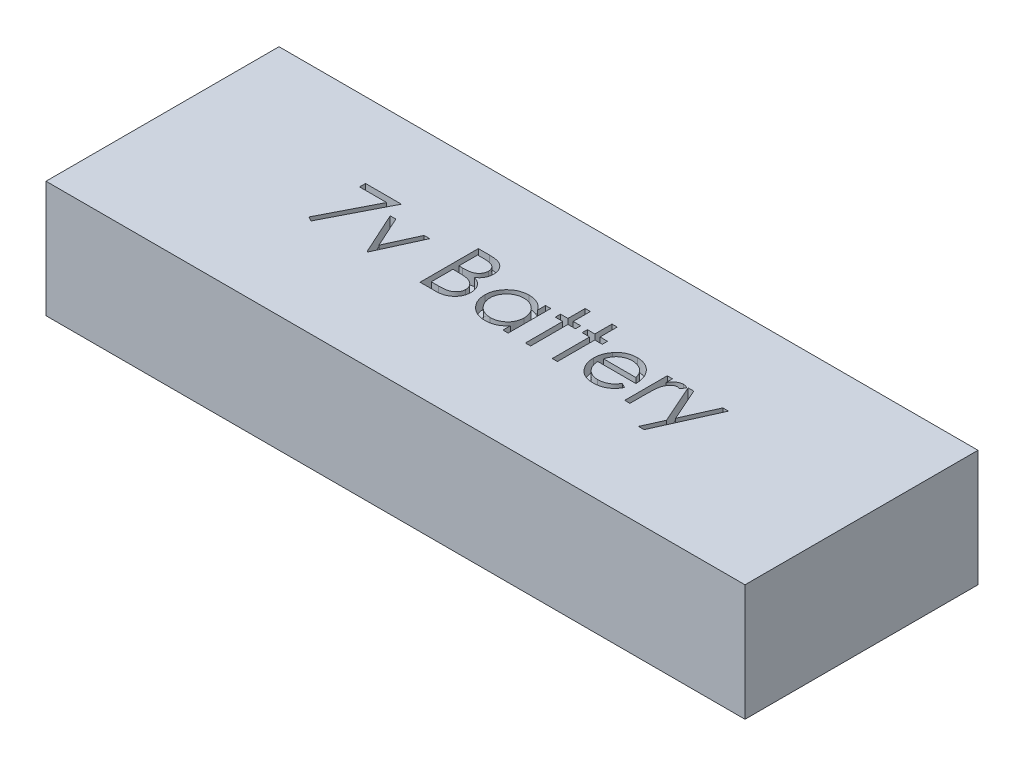
from build123d import *

# Parameters (mm, degrees)
SKETCH1_W           = 152.4
SKETCH1_H           = 50.8
BOSS_EXTRUDE1_DEPTH = 25.4
CUT_EXTRUDE1_DEPTH  = 2.54


with BuildPart() as part:
    # Sketch1 → Boss-Extrude1 (new body)
    with BuildSketch(Plane(origin=(0, 0, 0), x_dir=(1, 0, 0), z_dir=(0, 1, 0))):
        Rectangle(SKETCH1_W, SKETCH1_H)
    extrude(amount=BOSS_EXTRUDE1_DEPTH)

    # Sketch2 → Cut-Extrude1 (cut)
    # profile 1 of 9: a face of its own
    with BuildSketch(Plane(origin=(0, 25.4, 0), x_dir=(1, 0, 0), z_dir=(0, 1, 0))):
        Polygon((-40.938360226, 9.009477138), (-33.122975611, 9.009477138), (-39.798616636, -4.016163888), (-40.783171925, -3.474276869), (-35.051381059, 7.706913035), (-40.938360226, 7.706913035), align=None)
    # profile 2 of 9: a face of its own
    with BuildSketch(Plane(origin=(0, 25.4, 0), x_dir=(1, 0, 0), z_dir=(0, 1, 0))):
        Polygon((-32.146052534, 5.590246368), (-30.912178335, 5.590246368), (-27.831308944, -1.166804914), (-24.750439553, 5.590246368), (-23.516565354, 5.590246368), (-27.749898688, -3.690522862), (-27.9127192, -3.690522862), align=None)
    # profile 3 of 9: a face of its own
    with BuildSketch(Plane(origin=(0, 25.4, 0), x_dir=(1, 0, 0), z_dir=(0, 1, 0))):
        with BuildLine():
            Line((-16.35246279, 9.009477138), (-13.874538111, 9.009477138))
            add(Edge.make_bspline(
                [(-13.874538111, 9.009477138), (-13.75324049, 9.008839415), (-13.518135512, 9.007603349), (-13.176253538, 8.98843313), (-12.856036425, 8.9622941), (-12.557391308, 8.920819192), (-12.280456188, 8.870774744), (-12.024396476, 8.810171011), (-11.790026422, 8.737503013), (-11.51021735, 8.621946507), (-11.191190952, 8.45023101), (-10.845756784, 8.196490216), (-10.550375687, 7.886129565), (-10.295699622, 7.536035358), (-10.093221273, 7.150914129), (-9.946738394, 6.739945072), (-9.853999818, 6.308429037), (-9.844462357, 6.012180935), (-9.839642277, 5.862461913)],
                knots=[0, 0, 0, 0, 1.001505555, 1.941167018, 2.826882275, 3.653841531, 4.429895133, 5.150066043, 5.825578002, 6.45369114, 7.647487171, 8.808567382, 9.977351308, 11.170798116, 12.373658725, 13.556498008, 14.765093433, 16, 16, 16, 16], degree=3))
            add(Edge.make_bspline(
                [(-9.839642277, 5.862461913), (-9.843609099, 5.722208354), (-9.851404276, 5.446596884), (-9.925945146, 5.043483973), (-10.042642429, 4.659758122), (-10.204858618, 4.296819752), (-10.415685862, 3.962869213), (-10.665543189, 3.655212562), (-10.966993301, 3.386875869), (-11.192847344, 3.236860194), (-11.307570963, 3.160659029)],
                knots=[0, 0, 0, 0, 1.044552857, 2.05264487, 3.044412934, 4.028983338, 5.005914585, 5.980388656, 6.974128949, 8, 8, 8, 8], degree=3))
            add(Edge.make_bspline(
                [(-11.307570963, 3.160659029), (-11.163297412, 3.10526889), (-10.887266368, 2.999293833), (-10.507405695, 2.811930863), (-10.180127257, 2.608142634), (-9.902914756, 2.385595635), (-9.665832408, 2.145715093), (-9.458811734, 1.884983678), (-9.282167891, 1.600000185), (-9.130809568, 1.293735929), (-9.012704082, 0.969318172), (-8.924254372, 0.629789927), (-8.873572485, 0.276368684), (-8.866360187, 0.035847451), (-8.8627192, -0.085574946)],
                knots=[0, 0, 0, 0, 1.27268992, 2.434971085, 3.483601985, 4.442670788, 5.356604649, 6.2567628, 7.179492994, 8.113709626, 9.066344395, 10.018646069, 10.999752585, 12, 12, 12, 12], degree=3))
            add(Edge.make_bspline(
                [(-8.8627192, -0.085574946), (-8.866263756, -0.209551882), (-8.873237768, -0.453479977), (-8.924690809, -0.811820036), (-9.011809569, -1.154266271), (-9.131810585, -1.483033648), (-9.288428127, -1.797486136), (-9.479029598, -2.09797998), (-9.7062927, -2.38149598), (-9.960520824, -2.651184555), (-10.248129181, -2.893673955), (-10.558429206, -3.109630947), (-10.895328709, -3.28723523), (-11.253294516, -3.436427651), (-11.636342178, -3.550390914), (-12.042751639, -3.630119968), (-12.472172391, -3.683841102), (-12.766847774, -3.688257817), (-12.917967598, -3.690522862)],
                knots=[0, 0, 0, 0, 0.978564426, 1.925352924, 2.850884081, 3.763762016, 4.682927383, 5.618979971, 6.567305752, 7.547517671, 8.540179244, 9.531824382, 10.526200242, 11.540722885, 12.589160233, 13.674978461, 14.80764778, 16, 16, 16, 16], degree=3))
            Line((-12.917967598, -3.690522862), (-16.35246279, -3.690522862))
            Line((-16.35246279, -3.690522862), (-16.35246279, 9.009477138))
        make_face()
        with BuildLine():
            Line((-15.2127192, 7.706913035), (-15.2127192, 3.636400215))
            Line((-15.2127192, 3.636400215), (-14.446953976, 3.636400215))
            add(Edge.make_bspline(
                [(-14.446953976, 3.636400215), (-14.335016919, 3.637851364), (-14.118731712, 3.64065528), (-13.805513802, 3.648687184), (-13.51477445, 3.671177228), (-13.247015513, 3.693660807), (-13.002658645, 3.730217168), (-12.782245205, 3.773731443), (-12.58231601, 3.81975227), (-12.35175823, 3.898018694), (-12.090236389, 4.013689115), (-11.811441982, 4.193201206), (-11.565662621, 4.407012431), (-11.35811854, 4.653722492), (-11.188259776, 4.925379795), (-11.070281438, 5.217649904), (-10.990281292, 5.523248669), (-10.983054879, 5.733046329), (-10.979385867, 5.839565279)],
                knots=[0, 0, 0, 0, 1.156816544, 2.235205308, 3.236616184, 4.169592532, 5.011045266, 5.787822928, 6.49130361, 7.128639758, 8.301311294, 9.436451833, 10.541879658, 11.654887649, 12.756523258, 13.837046038, 14.901820046, 16, 16, 16, 16], degree=3))
            add(Edge.make_bspline(
                [(-10.979385867, 5.839565279), (-10.98129515, 5.910053078), (-10.985040415, 6.048322594), (-11.015713828, 6.249887393), (-11.067847598, 6.439457581), (-11.134810319, 6.619631067), (-11.228386418, 6.784774066), (-11.338562413, 6.940596519), (-11.471679061, 7.081791921), (-11.623198453, 7.213761243), (-11.79740117, 7.330762816), (-11.994183286, 7.433236442), (-12.216207143, 7.515752974), (-12.459730931, 7.588020156), (-12.728503163, 7.63877768), (-13.019422256, 7.681062829), (-13.334871094, 7.702590207), (-13.553111895, 7.705439953), (-13.665924329, 7.706913035)],
                knots=[0, 0, 0, 0, 0.91205012, 1.789085906, 2.630437955, 3.453916878, 4.269457761, 5.079663411, 5.91843418, 6.774407191, 7.675494373, 8.627863946, 9.638891023, 10.736472738, 11.911756761, 13.175263542, 14.539845004, 16, 16, 16, 16], degree=3))
            Line((-13.665924329, 7.706913035), (-15.2127192, 7.706913035))
        make_face(mode=Mode.SUBTRACT)
        with BuildLine():
            Line((-15.2127192, 2.333836112), (-15.2127192, -2.38795876))
            Line((-15.2127192, -2.38795876), (-13.589602213, -2.38795876))
            add(Edge.make_bspline(
                [(-13.589602213, -2.38795876), (-13.473419254, -2.386566305), (-13.249491915, -2.383882532), (-12.926181737, -2.375121148), (-12.626523046, -2.355192033), (-12.35188324, -2.32381995), (-12.09929674, -2.289789578), (-11.871793646, -2.244028644), (-11.667529773, -2.191599559), (-11.430677285, -2.110558419), (-11.163964555, -1.984659796), (-10.876542304, -1.794833889), (-10.620995741, -1.568689315), (-10.403988087, -1.306957141), (-10.226140957, -1.022363469), (-10.096762591, -0.720664628), (-10.016967197, -0.406845714), (-10.007307325, -0.192880786), (-10.00246279, -0.085574946)],
                knots=[0, 0, 0, 0, 1.160039823, 2.235823828, 3.228722157, 4.157150951, 4.99529583, 5.772374946, 6.472645482, 7.099169577, 8.269452708, 9.405989375, 10.527446681, 11.663510218, 12.788923519, 13.866172445, 14.929861265, 16, 16, 16, 16], degree=3))
            add(Edge.make_bspline(
                [(-10.00246279, -0.085574946), (-10.003464655, -0.018470539), (-10.005452223, 0.114655875), (-10.035426454, 0.310293276), (-10.079019639, 0.499798588), (-10.135376556, 0.683686389), (-10.217452908, 0.858632069), (-10.313270943, 1.028095642), (-10.4256166, 1.192301125), (-10.600674002, 1.399899873), (-10.85529806, 1.639084463), (-11.217091217, 1.873263399), (-11.628470698, 2.062122585), (-11.92683903, 2.142312114), (-12.080968399, 2.183735952)],
                knots=[0, 0, 0, 0, 0.723448775, 1.435228256, 2.130040452, 2.821711965, 3.505591119, 4.210454504, 4.921174351, 5.648778258, 7.137944449, 8.670945889, 10.280296675, 12, 12, 12, 12], degree=3))
            add(Edge.make_bspline(
                [(-12.080968399, 2.183735952), (-12.14275969, 2.196272971), (-12.276735954, 2.223455814), (-12.49520346, 2.25214948), (-12.74461647, 2.277712983), (-13.02555091, 2.296622041), (-13.338362219, 2.316167499), (-13.683718467, 2.323768707), (-14.060209294, 2.332837451), (-14.32143876, 2.333494709), (-14.457130258, 2.333836112)],
                knots=[0, 0, 0, 0, 0.634451884, 1.375622551, 2.216452059, 3.157844607, 4.20941857, 5.370758133, 6.634282058, 8, 8, 8, 8], degree=3))
            Line((-14.457130258, 2.333836112), (-15.2127192, 2.333836112))
        make_face(mode=Mode.SUBTRACT)
    # profile 4 of 9: a face of its own
    with BuildSketch(Plane(origin=(0, 25.4, 0), x_dir=(1, 0, 0), z_dir=(0, 1, 0))):
        with BuildLine():
            Line((2.860357723, 5.590246368), (2.860357723, -3.690522862))
            Line((2.860357723, -3.690522862), (1.720614133, -3.690522862))
            Line((1.720614133, -3.690522862), (1.720614133, -2.085214369))
            add(Edge.make_bspline(
                [(1.720614133, -2.085214369), (1.592094521, -2.230500895), (1.341286883, -2.514029379), (0.922400541, -2.884441834), (0.478378866, -3.1906146), (0.01137693, -3.437901437), (-0.478183553, -3.62365547), (-0.989217356, -3.755685248), (-1.521932938, -3.84057145), (-1.885705768, -3.849047872), (-2.070050931, -3.853343375)],
                knots=[0, 0, 0, 0, 1.074387032, 2.096679803, 3.090159297, 4.057316773, 5.018401886, 5.985159533, 6.978961417, 8, 8, 8, 8], degree=3))
            add(Edge.make_bspline(
                [(-2.070050931, -3.853343375), (-2.233946078, -3.848893396), (-2.557154564, -3.840117839), (-3.03260293, -3.772037481), (-3.490137664, -3.662706368), (-3.930191113, -3.510665997), (-4.349915755, -3.308987016), (-4.752905249, -3.067537345), (-5.137071874, -2.780006333), (-5.49656003, -2.451301201), (-5.82760186, -2.094267962), (-6.118109906, -1.713465549), (-6.360328224, -1.310540618), (-6.562875374, -0.890594602), (-6.718890681, -0.450394751), (-6.827652154, 0.008536687), (-6.895653204, 0.485657085), (-6.904425132, 0.81055764), (-6.908873047, 0.975302458)],
                knots=[0, 0, 0, 0, 1.033919861, 2.038935746, 3.024066025, 3.998881131, 4.97069526, 5.957263378, 6.95902576, 7.993208707, 9.027059324, 10.027763471, 11.009749337, 11.988697705, 12.965288445, 13.950418724, 14.960734635, 16, 16, 16, 16], degree=3))
            add(Edge.make_bspline(
                [(-6.908873047, 0.975302458), (-6.90432655, 1.136642182), (-6.895338373, 1.455602114), (-6.828379547, 1.924699104), (-6.715781315, 2.376522507), (-6.557764839, 2.809617701), (-6.355138317, 3.22450874), (-6.108656401, 3.621489059), (-5.818301292, 4.001652302), (-5.483556843, 4.356059325), (-5.120936392, 4.683431268), (-4.733010425, 4.96794409), (-4.329428804, 5.213659513), (-3.903931595, 5.408344984), (-3.462816671, 5.56585802), (-3.002157025, 5.67483479), (-2.523869297, 5.739050785), (-2.199146655, 5.748349957), (-2.034433944, 5.753066881)],
                knots=[0, 0, 0, 0, 1.020392517, 2.01726096, 2.990465484, 3.961182959, 4.928053699, 5.906110375, 6.912531644, 7.948652711, 8.985773172, 9.998621852, 10.987621588, 11.969261332, 12.953316658, 13.946091881, 14.958173133, 16, 16, 16, 16], degree=3))
            add(Edge.make_bspline(
                [(-2.034433944, 5.753066881), (-1.845023027, 5.747849897), (-1.473597158, 5.737619637), (-0.930298381, 5.652483455), (-0.416331276, 5.508652446), (0.072271659, 5.313008953), (0.533755863, 5.053026422), (0.963752406, 4.725076278), (1.366761445, 4.331226828), (1.600369932, 4.028711215), (1.720614133, 3.872998772)],
                knots=[0, 0, 0, 0, 1.038897134, 2.037228247, 3.008116434, 3.962042015, 4.918381754, 5.904844433, 6.921570401, 8, 8, 8, 8], degree=3))
            Line((1.720614133, 3.872998772), (1.720614133, 5.590246368))
            Line((1.720614133, 5.590246368), (2.860357723, 5.590246368))
        make_face()
        with BuildLine():
            add(Edge.make_bspline(
                [(-2.019169521, 4.613323291), (-2.185772976, 4.60739552), (-2.514621695, 4.595695043), (-2.99738136, 4.504351217), (-3.459347177, 4.352369975), (-3.898208646, 4.144518505), (-4.307033318, 3.883157089), (-4.672407495, 3.567030927), (-4.997319583, 3.20476519), (-5.270580999, 2.797994675), (-5.493340802, 2.361919888), (-5.649975461, 1.906082641), (-5.753278158, 1.438704579), (-5.763831933, 1.121702834), (-5.769129457, 0.962582106)],
                knots=[0, 0, 0, 0, 1.031046209, 2.035121221, 3.029706178, 4.034933723, 5.034054252, 6.02443088, 7.017295772, 8.038157696, 9.050218397, 10.03989886, 11.016116709, 12, 12, 12, 12], degree=3))
            add(Edge.make_bspline(
                [(-5.769129457, 0.962582106), (-5.762362558, 0.804412288), (-5.748855285, 0.488692625), (-5.65178848, 0.02067739), (-5.488938653, -0.435267277), (-5.266717454, -0.875271454), (-4.988454559, -1.283790904), (-4.665915734, -1.652962206), (-4.295981856, -1.970424426), (-3.88621633, -2.236172193), (-3.448581695, -2.450847626), (-2.988355715, -2.600220089), (-2.514189828, -2.696659465), (-2.191782788, -2.707924281), (-2.029345803, -2.713599785)],
                knots=[0, 0, 0, 0, 0.979072187, 1.954306742, 2.945804271, 3.96968567, 4.997920485, 5.998718438, 6.996577872, 8.005894225, 9.015743152, 10.005417472, 10.995077863, 12, 12, 12, 12], degree=3))
            add(Edge.make_bspline(
                [(-2.029345803, -2.713599785), (-1.864439922, -2.707576488), (-1.536458479, -2.695596746), (-1.052266596, -2.603861869), (-0.582384874, -2.452300801), (-0.133214074, -2.242209684), (0.285218745, -1.981832993), (0.660768186, -1.677007262), (0.978326129, -1.32248428), (1.247539312, -0.93286115), (1.458632967, -0.505734763), (1.612397525, -0.050950699), (1.703307411, 0.431506872), (1.714765459, 0.761213122), (1.720614133, 0.929509189)],
                knots=[0, 0, 0, 0, 1.01762866, 2.023962475, 3.030623092, 4.058876274, 5.077231937, 6.066672613, 7.034107872, 8.005628644, 8.981990164, 9.965428785, 10.961468474, 12, 12, 12, 12], degree=3))
            add(Edge.make_bspline(
                [(1.720614133, 0.929509189), (1.717131951, 1.057735031), (1.710277916, 1.310124066), (1.657915563, 1.680701059), (1.574621973, 2.035334865), (1.457251585, 2.374398336), (1.303068924, 2.696016821), (1.117112745, 3.002499608), (0.89611297, 3.292252689), (0.643627187, 3.561286118), (0.36725631, 3.806673567), (0.074813262, 4.025709526), (-0.237166762, 4.20564593), (-0.563437154, 4.354567115), (-0.904563996, 4.473073173), (-1.263323102, 4.552131376), (-1.63590114, 4.60641597), (-1.890068255, 4.610996609), (-2.019169521, 4.613323291)],
                knots=[0, 0, 0, 0, 1.050140795, 2.067009409, 3.05949893, 4.030605086, 5.00011959, 5.97591094, 6.962425594, 7.979863591, 8.993523472, 9.986985069, 10.967611495, 11.937549037, 12.921786183, 13.919465291, 14.943216303, 16, 16, 16, 16], degree=3))
        make_face(mode=Mode.SUBTRACT)
    # profile 5 of 9: a face of its own
    with BuildSketch(Plane(origin=(0, 25.4, 0), x_dir=(1, 0, 0), z_dir=(0, 1, 0))):
        Polygon((6.605229517, 9.335118163), (7.744973107, 9.335118163), (7.744973107, 5.590246368), (9.373178235, 5.590246368), (9.373178235, 4.450502779), (7.744973107, 4.450502779), (7.744973107, -3.690522862), (6.605229517, -3.690522862), (6.605229517, 4.450502779), (4.977024389, 4.450502779), (4.977024389, 5.590246368), (6.605229517, 5.590246368), align=None)
    # profile 6 of 9: a face of its own
    with BuildSketch(Plane(origin=(0, 25.4, 0), x_dir=(1, 0, 0), z_dir=(0, 1, 0))):
        Polygon((12.466767979, 9.335118163), (13.606511569, 9.335118163), (13.606511569, 5.590246368), (15.234716697, 5.590246368), (15.234716697, 4.450502779), (13.606511569, 4.450502779), (13.606511569, -3.690522862), (12.466767979, -3.690522862), (12.466767979, 4.450502779), (10.838562851, 4.450502779), (10.838562851, 5.590246368), (12.466767979, 5.590246368), align=None)
    # profile 7 of 9: a face of its own
    with BuildSketch(Plane(origin=(0, 25.4, 0), x_dir=(1, 0, 0), z_dir=(0, 1, 0))):
        with BuildLine():
            Line((24.805509966, -0.759753632), (25.81805003, -1.291464369))
            add(Edge.make_bspline(
                [(25.81805003, -1.291464369), (25.737362956, -1.434587314), (25.580377863, -1.713047887), (25.310409434, -2.095614923), (25.027409628, -2.439776635), (24.718603801, -2.736338524), (24.393230966, -2.994879263), (24.049486762, -3.221076513), (23.685581623, -3.413820858), (23.301498336, -3.576208602), (22.894011394, -3.701065909), (22.46213332, -3.789255511), (22.005036751, -3.843768514), (21.691723469, -3.850100882), (21.531291216, -3.853343375)],
                knots=[0, 0, 0, 0, 1.120438281, 2.179929193, 3.190490725, 4.156257408, 5.095198341, 6.022838206, 6.959905092, 7.901321166, 8.864066838, 9.862729781, 10.905609505, 12, 12, 12, 12], degree=3))
            add(Edge.make_bspline(
                [(21.531291216, -3.853343375), (21.352976041, -3.849180768), (21.005134791, -3.841060726), (20.498804852, -3.771056641), (20.022085248, -3.656856939), (19.575002781, -3.497324832), (19.158652322, -3.288945684), (18.772206363, -3.035092707), (18.413632655, -2.737069955), (18.094230524, -2.392296003), (17.806688436, -2.023335757), (17.552957603, -1.638867262), (17.340840639, -1.239857848), (17.168292596, -0.828847661), (17.028937801, -0.408427247), (16.931812904, 0.02522865), (16.875824961, 0.470946341), (16.867245402, 0.772470959), (16.862921825, 0.924421048)],
                knots=[0, 0, 0, 0, 1.145258523, 2.234067595, 3.276747158, 4.290159414, 5.277019952, 6.260822364, 7.254936242, 8.264827045, 9.274100331, 10.257902744, 11.220704747, 12.172965371, 13.118907548, 14.062713208, 15.023725156, 16, 16, 16, 16], degree=3))
            add(Edge.make_bspline(
                [(16.862921825, 0.924421048), (16.866764995, 1.067005147), (16.874381651, 1.349588002), (16.922390508, 1.767837263), (17.007474314, 2.174340505), (17.124228404, 2.569435502), (17.275000068, 2.952460731), (17.459448407, 3.323649305), (17.677860749, 3.682606241), (17.846490165, 3.909040469), (17.931431441, 4.023098932)],
                knots=[0, 0, 0, 0, 1.024358464, 2.0301432, 3.019427413, 4.004406732, 4.986367066, 5.972626655, 6.978780325, 8, 8, 8, 8], degree=3))
            add(Edge.make_bspline(
                [(17.931431441, 4.023098932), (18.046485032, 4.160508833), (18.27294761, 4.430975836), (18.655966385, 4.786352046), (19.070712812, 5.084053745), (19.511989284, 5.330822496), (19.98492449, 5.518324015), (20.48316106, 5.658051528), (21.012372187, 5.736348882), (21.374159703, 5.747408164), (21.559275992, 5.753066881)],
                knots=[0, 0, 0, 0, 1.030682036, 2.02871468, 2.997146059, 3.962720338, 4.930598197, 5.918074684, 6.934738563, 8, 8, 8, 8], degree=3))
            add(Edge.make_bspline(
                [(21.559275992, 5.753066881), (21.749585874, 5.748153618), (22.122930481, 5.738514916), (22.667332748, 5.649156506), (23.182447348, 5.507451522), (23.66806815, 5.307322054), (24.124244387, 5.049114537), (24.54801091, 4.72928557), (24.94661497, 4.357654225), (25.178511813, 4.071856293), (25.296515575, 3.926424253)],
                knots=[0, 0, 0, 0, 1.056321875, 2.072262726, 3.055038591, 4.01806755, 4.982017516, 5.957941055, 6.960871419, 8, 8, 8, 8], degree=3))
            add(Edge.make_bspline(
                [(25.296515575, 3.926424253), (25.376804751, 3.816828401), (25.536848675, 3.598366198), (25.737316724, 3.242145143), (25.911333557, 2.869452415), (26.050427444, 2.474263622), (26.163056491, 2.061261146), (26.244542662, 1.627492483), (26.292329564, 1.173086805), (26.301722837, 0.863473304), (26.306511569, 0.705630984)],
                knots=[0, 0, 0, 0, 0.94817472, 1.890038105, 2.849395472, 3.817997239, 4.812318967, 5.836947057, 6.897266129, 8, 8, 8, 8], degree=3))
            Line((26.306511569, 0.705630984), (18.002665415, 0.705630984))
            add(Edge.make_bspline(
                [(18.002665415, 0.705630984), (18.008251987, 0.583346442), (18.019237755, 0.342878823), (18.07045556, -0.00898659), (18.151186825, -0.34416986), (18.264648852, -0.660156898), (18.402051405, -0.96107479), (18.570365292, -1.244691324), (18.771168816, -1.50971467), (18.995144925, -1.758515426), (19.244453529, -1.98007876), (19.50673664, -2.178386633), (19.785750433, -2.344595513), (20.079294907, -2.479505399), (20.386895385, -2.585119746), (20.708648778, -2.657211552), (21.043921943, -2.70549734), (21.272470178, -2.710866411), (21.388823267, -2.713599785)],
                knots=[0, 0, 0, 0, 1.094153842, 2.151609401, 3.174256925, 4.172055639, 5.149267565, 6.128595816, 7.11444997, 8.118368179, 9.117203808, 10.09244225, 11.054858984, 12.015122123, 12.976791628, 13.957293641, 14.960065497, 16, 16, 16, 16], degree=3))
            add(Edge.make_bspline(
                [(21.388823267, -2.713599785), (21.502583146, -2.711393408), (21.728304567, -2.707015533), (22.064458535, -2.664445456), (22.395164821, -2.595610456), (22.719054674, -2.501666778), (23.029554601, -2.387087915), (23.317102739, -2.248828974), (23.581553808, -2.095885607), (23.828721086, -1.920953358), (24.068464405, -1.706837936), (24.306289999, -1.439645463), (24.561293855, -1.123642148), (24.720913235, -0.885805017), (24.805509966, -0.759753632)],
                knots=[0, 0, 0, 0, 0.99110716, 1.966546729, 2.947904876, 3.932708344, 4.903319531, 5.828989031, 6.710028674, 7.56322171, 8.463672341, 9.504779593, 10.677557249, 12, 12, 12, 12], degree=3))
        make_face()
        with BuildLine():
            add(Edge.make_bspline(
                [(25.166767979, 1.845374573), (25.125051656, 1.996551287), (25.044761162, 2.287517796), (24.876989211, 2.690437598), (24.688043906, 3.048533696), (24.464445052, 3.359065507), (24.211102819, 3.634849683), (23.918476013, 3.875854264), (23.590322914, 4.091454729), (23.228339747, 4.273436656), (22.845010984, 4.428339857), (22.443668516, 4.532208134), (22.034155971, 4.603362759), (21.757171561, 4.609988924), (21.617789614, 4.613323291)],
                knots=[0, 0, 0, 0, 1.154881502, 2.222775134, 3.210006277, 4.132804581, 5.035138423, 5.962687519, 6.919655026, 7.923214229, 8.944639381, 9.960483929, 10.97369054, 12, 12, 12, 12], degree=3))
            add(Edge.make_bspline(
                [(21.617789614, 4.613323291), (21.504035937, 4.611103798), (21.279168833, 4.606716325), (20.947876386, 4.565096141), (20.629724335, 4.49629899), (20.322365149, 4.40208329), (20.029826569, 4.276503504), (19.746091267, 4.129244367), (19.47837383, 3.949479192), (19.310946843, 3.81246849), (19.226363332, 3.743251176)],
                knots=[0, 0, 0, 0, 1.04873581, 2.073130211, 3.073294108, 4.04793562, 5.032784715, 6.005352987, 6.992311501, 8, 8, 8, 8], degree=3))
            add(Edge.make_bspline(
                [(19.226363332, 3.743251176), (19.165790566, 3.688480374), (19.04320605, 3.577637618), (18.879410443, 3.386668783), (18.722581871, 3.180741686), (18.579856903, 2.951977948), (18.448946803, 2.70298255), (18.326446314, 2.435855702), (18.216187048, 2.148570344), (18.154152591, 1.948373207), (18.122236729, 1.845374573)],
                knots=[0, 0, 0, 0, 0.879870761, 1.780643979, 2.707998968, 3.669668524, 4.684282772, 5.740141944, 6.837334558, 8, 8, 8, 8], degree=3))
            Line((18.122236729, 1.845374573), (25.166767979, 1.845374573))
        make_face(mode=Mode.SUBTRACT)
    # profile 8 of 9: a face of its own
    with BuildSketch(Plane(origin=(0, 25.4, 0), x_dir=(1, 0, 0), z_dir=(0, 1, 0))):
        with BuildLine():
            Line((28.260357723, 5.590246368), (29.400101312, 5.590246368))
            Line((29.400101312, 5.590246368), (29.400101312, 4.224080503))
            add(Edge.make_bspline(
                [(29.400101312, 4.224080503), (29.48424338, 4.35128308), (29.64516443, 4.59455702), (29.912637059, 4.916299913), (30.18660629, 5.182691653), (30.468383684, 5.39497585), (30.760041361, 5.553954881), (31.0551783, 5.670406751), (31.358437862, 5.739267295), (31.562225416, 5.748460857), (31.664324069, 5.753066881)],
                knots=[0, 0, 0, 0, 1.2804753, 2.448899062, 3.506932113, 4.484331642, 5.4025378, 6.288909075, 7.142734305, 8, 8, 8, 8], degree=3))
            add(Edge.make_bspline(
                [(31.664324069, 5.753066881), (31.743522453, 5.74874697), (31.906478277, 5.739858473), (32.15315796, 5.677407767), (32.407315628, 5.577701799), (32.571118005, 5.483938705), (32.656511569, 5.435058067)],
                knots=[0, 0, 0, 0, 0.901110191, 1.854092781, 2.881294221, 4, 4, 4, 4], degree=3))
            Line((32.656511569, 5.435058067), (32.030670223, 4.447958708))
            add(Edge.make_bspline(
                [(32.030670223, 4.447958708), (31.97584606, 4.472416245), (31.871779305, 4.518841333), (31.719544164, 4.573785198), (31.579186171, 4.606137235), (31.489765259, 4.61103841), (31.448078075, 4.613323291)],
                knots=[0, 0, 0, 0, 1.180555205, 2.24091978, 3.179933427, 4, 4, 4, 4], degree=3))
            add(Edge.make_bspline(
                [(31.448078075, 4.613323291), (31.356617271, 4.607227156), (31.170063741, 4.594792806), (30.896162844, 4.497043418), (30.630380126, 4.339108975), (30.419300095, 4.163953798), (30.255861063, 3.99505179), (30.139237959, 3.847556158), (30.032257705, 3.682170838), (29.930040049, 3.501723128), (29.836908067, 3.303131973), (29.749986838, 3.088381455), (29.671396107, 2.857222845), (29.626582364, 2.6961777), (29.603626953, 2.613683868)],
                knots=[0, 0, 0, 0, 1.125678352, 2.296057538, 3.5422874, 4.923748041, 5.663163013, 6.437101912, 7.23742474, 8.08941207, 8.991984279, 9.93940061, 10.944477711, 12, 12, 12, 12], degree=3))
            add(Edge.make_bspline(
                [(29.603626953, 2.613683868), (29.586455126, 2.540106696), (29.548420833, 2.377138849), (29.51144011, 2.103731345), (29.474902145, 1.780702641), (29.449151558, 1.407153575), (29.425282663, 0.984016993), (29.411820364, 0.510648276), (29.400560397, -0.013438456), (29.400258983, -0.379831109), (29.400101312, -0.571492414)],
                knots=[0, 0, 0, 0, 0.566838948, 1.255505196, 2.06880316, 3.007127437, 4.065329342, 5.249902469, 6.561414163, 8, 8, 8, 8], degree=3))
            Line((29.400101312, -0.571492414), (29.400101312, -3.690522862))
            Line((29.400101312, -3.690522862), (28.260357723, -3.690522862))
            Line((28.260357723, -3.690522862), (28.260357723, 5.590246368))
        make_face()
    # profile 9 of 9: a face of its own
    with BuildSketch(Plane(origin=(0, 25.4, 0), x_dir=(1, 0, 0), z_dir=(0, 1, 0))):
        Polygon((32.819332082, 5.590246368), (34.048118139, 5.590246368), (37.190045223, -1.517886644), (40.380309646, 5.590246368), (41.611639774, 5.590246368), (35.912921825, -7.109753632), (34.681591697, -7.109753632), (36.571836088, -2.899316933), align=None)
    extrude(amount=-CUT_EXTRUDE1_DEPTH, mode=Mode.SUBTRACT)


solid = part.part
